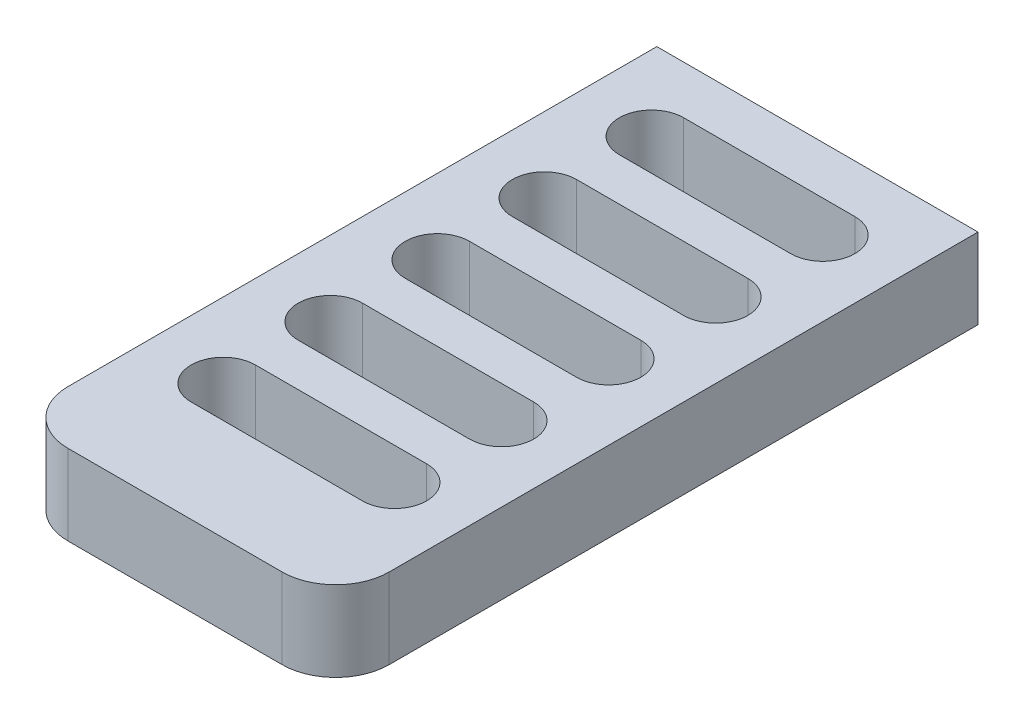
from build123d import *

# Parameters (mm, degrees)
EXTRUDE_1_DEPTH = 15


with BuildPart() as part:
    # Эскиз1 → Бобышка-Вытянуть1 (new body)
    with BuildSketch(Plane(origin=(0, 0, 0), x_dir=(1, 0, 0), z_dir=(0, 1, 0))):
        with BuildLine():
            Line((10, 0), (50, 0))
            ThreePointArc((50, 0), (57.071067812, 2.928932188), (60, 10))
            Line((60, 10), (60, 120))
            Line((60, 120), (0, 120))
            Line((0, 120), (0, 10))
            ThreePointArc((0, 10), (2.928932188, 2.928932188), (10, 0))
        make_face()
        with BuildLine():
            Line((14, 111), (46, 111))
            ThreePointArc((46, 111), (52, 105), (46, 99))
            Line((46, 99), (14, 99))
            ThreePointArc((14, 99), (8, 105), (14, 111))
        make_face(mode=Mode.SUBTRACT)
        with BuildLine():
            Line((14, 91), (46, 91))
            ThreePointArc((46, 91), (52, 85), (46, 79))
            Line((46, 79), (14, 79))
            ThreePointArc((14, 79), (8, 85), (14, 91))
        make_face(mode=Mode.SUBTRACT)
        with BuildLine():
            Line((14, 71), (46, 71))
            ThreePointArc((46, 71), (52, 65), (46, 59))
            Line((46, 59), (14, 59))
            ThreePointArc((14, 59), (8, 65), (14, 71))
        make_face(mode=Mode.SUBTRACT)
        with BuildLine():
            Line((14, 51), (46, 51))
            ThreePointArc((46, 51), (52, 45), (46, 39))
            Line((46, 39), (14, 39))
            ThreePointArc((14, 39), (8, 45), (14, 51))
        make_face(mode=Mode.SUBTRACT)
        with BuildLine():
            Line((14, 31), (46, 31))
            ThreePointArc((46, 31), (52, 25), (46, 19))
            Line((46, 19), (14, 19))
            ThreePointArc((14, 19), (8, 25), (14, 31))
        make_face(mode=Mode.SUBTRACT)
    extrude(amount=EXTRUDE_1_DEPTH)


solid = part.part
